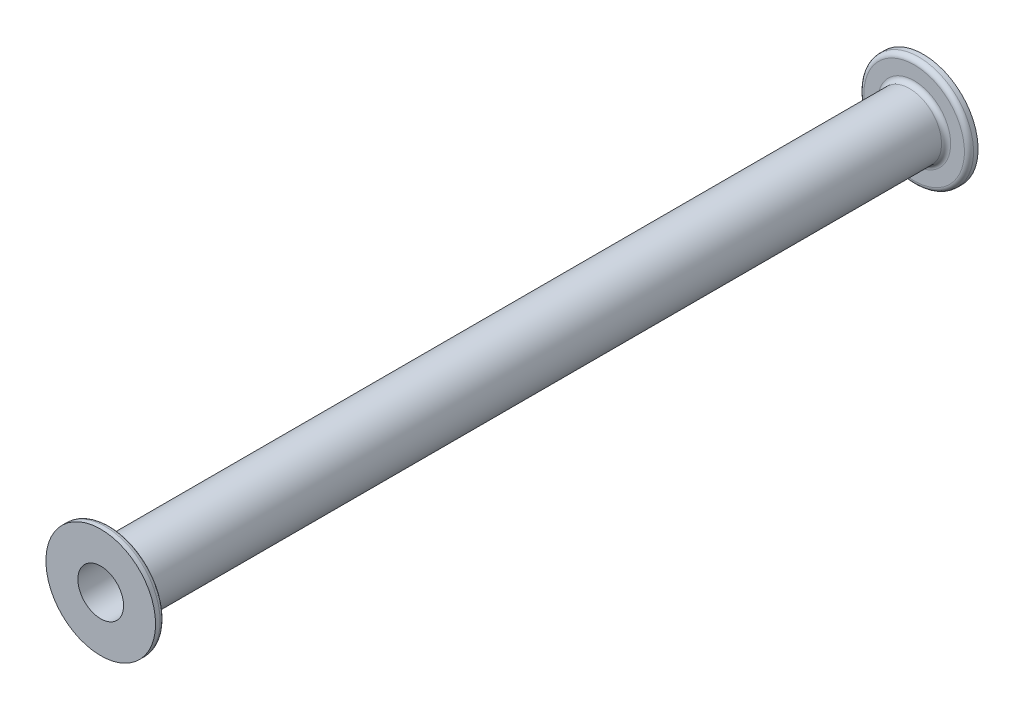
from build123d import *

# Parameters (mm, degrees)
SKETCH_1_R      = 3.5
SKETCH_1_R_2    = 2.5
EXTRUDE_1_DEPTH = 90
SKETCH_2_R      = 6
SKETCH_2_R_2    = 2.5
EXTRUDE_2_DEPTH = 1
EXTRUDE_START   = -1
SKETCH_3_R      = 6
SKETCH_3_R_2    = 2.5
EXTRUDE_3_DEPTH = 1
FILLET_1_R      = 0.5


with BuildPart() as part:
    # 草图1 → 凸台-拉伸1 (new body)
    with BuildSketch(Plane.XY):
        with Locations(Location((0, 0, 0), (0, 0, 180))):
            Circle(SKETCH_1_R)
        with Locations(Location((0, 0, 0), (0, 0, 180))):
            Circle(SKETCH_1_R_2, mode=Mode.SUBTRACT)
    extrude(amount=EXTRUDE_1_DEPTH)

    # 草图2 → 凸台-拉伸2 (add)
    with BuildSketch(Plane(origin=(0, 0, 0), x_dir=(-1, 0, 0), z_dir=(0, 0, -1))):
        Circle(SKETCH_2_R)
        Circle(SKETCH_2_R_2, mode=Mode.SUBTRACT)
    extrude(amount=-EXTRUDE_2_DEPTH)

    # 草图3 → 凸台-拉伸3 (add)
    with BuildSketch(Plane.XY.offset(90).offset(EXTRUDE_START)):
        with Locations(Location((0, 0, 0), (0, 0, 180))):
            Circle(SKETCH_3_R)
        with Locations(Location((0, 0, 0), (0, 0, 180))):
            Circle(SKETCH_3_R_2, mode=Mode.SUBTRACT)
    extrude(amount=EXTRUDE_3_DEPTH)

    # 圆角1
    fillet_1_edges = [part.edges().sort_by_distance(p)[0] for p in [
        (3.5, 0, 1),
        (6, 0, 1),
        (3.5, 0, 89),
        (6, 0, 89),
    ]]
    fillet(fillet_1_edges, radius=FILLET_1_R)


solid = part.part
